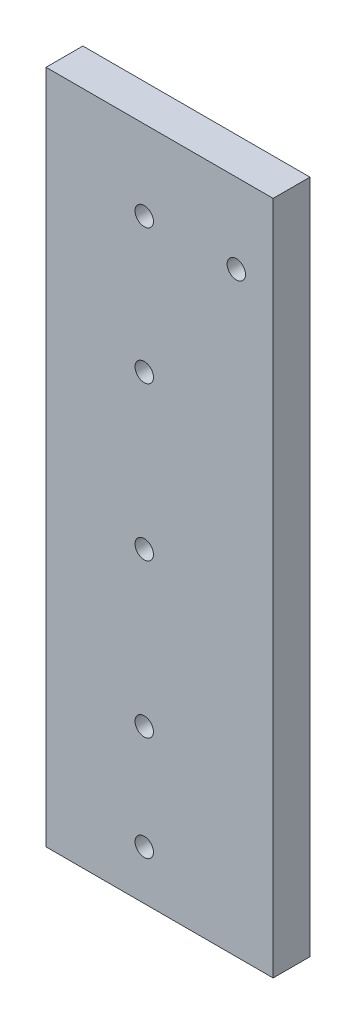
from build123d import *

# Parameters (mm, degrees)
SKETCH_1_W      = 185
SKETCH_1_H      = 550
SKETCH_1_R      = 7.5
EXTRUDE_1_DEPTH = 30


with BuildPart() as part:
    # 草图1 → 凸台-拉伸1 (new body)
    with BuildSketch(Plane.XY):
        Rectangle(SKETCH_1_W, SKETCH_1_H)
        with Locations((62.5, 210)):
            Circle(SKETCH_1_R, mode=Mode.SUBTRACT)
        with Locations((-12.5, 210)):
            Circle(SKETCH_1_R, mode=Mode.SUBTRACT)
        with Locations((-12.5, -235)):
            Circle(SKETCH_1_R, mode=Mode.SUBTRACT)
        with Locations((-12.5, -150)):
            Circle(SKETCH_1_R, mode=Mode.SUBTRACT)
        with Locations((-12.5, -25)):
            Circle(SKETCH_1_R, mode=Mode.SUBTRACT)
        with Locations((-12.5, 100)):
            Circle(SKETCH_1_R, mode=Mode.SUBTRACT)
    extrude(amount=EXTRUDE_1_DEPTH)


solid = part.part
